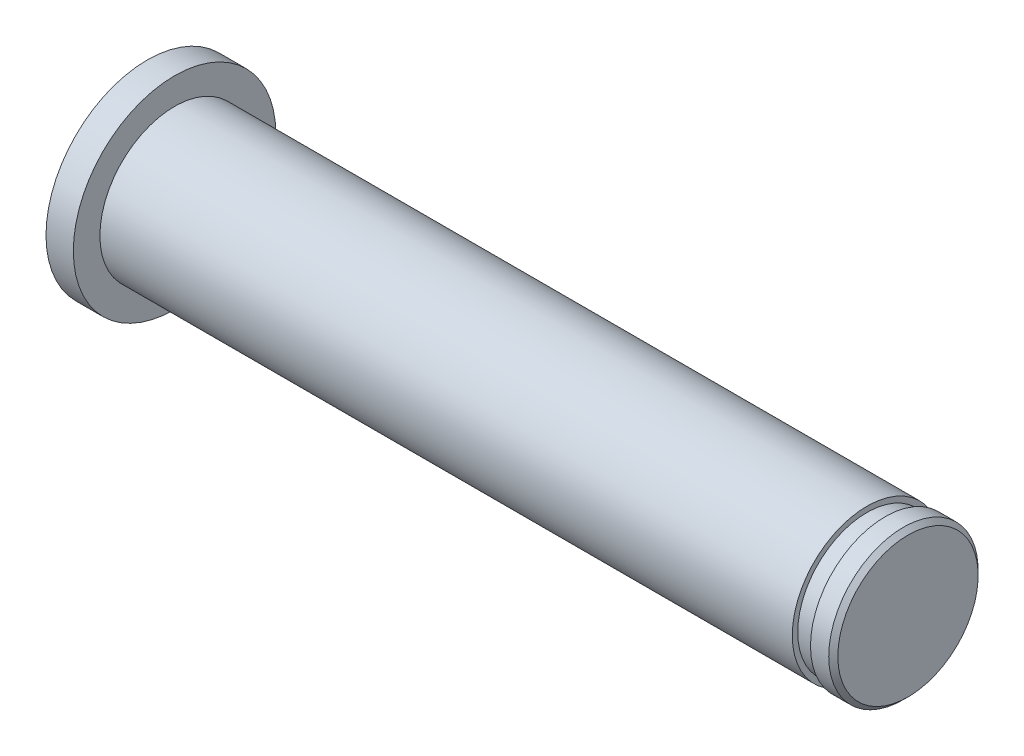
from build123d import *


with BuildPart() as part:
    # Croquis2 → Revolución1 (revolve)
    with BuildSketch(Plane.XY, mode=Mode.PRIVATE) as revoluci_n1_sk:
        Polygon((0, 0), (0, 11.115), (3, 11.115), (3, 8.2), (79, 8.2), (79, 7.6), (81, 7.6), (81, 8.2), (83, 8.2), (83.5, 7.7), (83.5, 0), align=None)
    revolve(revoluci_n1_sk.sketch.rotate(Axis((0, 0, 0), (1, 0, 0)), 90), axis=Axis((0, 0, 0), (1, 0, 0)))


solid = part.part
